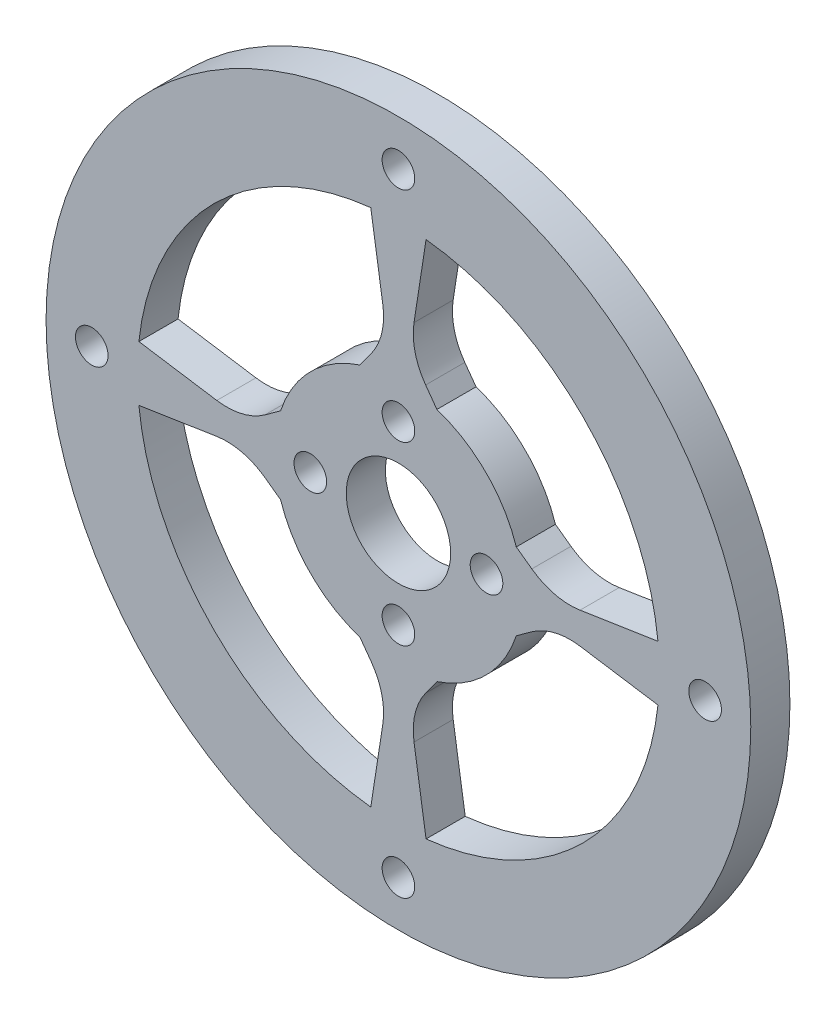
from build123d import *

# Parameters (mm, degrees)
SKETCH1_R             = 27
SKETCH1_R_2           = 1.25
SKETCH1_R_3           = 20
BOSS_EXTRUDE1_DEPTH   = 3
SKETCH1_R_4           = 9.5
SKETCH1_R_5           = 4
BOSS_EXTRUDE1_2_DEPTH = 3
BOSS_EXTRUDE2_DEPTH   = 3


with BuildPart() as part:
    # Sketch1 → Boss-Extrude1 (new body)
    with BuildSketch(Plane.XY):
        Circle(SKETCH1_R)
        with Locations((23.5, 0)):
            Circle(SKETCH1_R_2, mode=Mode.SUBTRACT)
        with Locations((0, -23.5)):
            Circle(SKETCH1_R_2, mode=Mode.SUBTRACT)
        with Locations((-23.5, 0)):
            Circle(SKETCH1_R_2, mode=Mode.SUBTRACT)
        with Locations((0, 23.5)):
            Circle(SKETCH1_R_2, mode=Mode.SUBTRACT)
        Circle(SKETCH1_R_3, mode=Mode.SUBTRACT)
    extrude(amount=BOSS_EXTRUDE1_DEPTH)



with BuildPart() as body_2:
    # Sketch1 → Boss-Extrude1 2 (new body)
    with BuildSketch(Plane.XY):
        Circle(SKETCH1_R_4)
        with Locations((6.75, 0)):
            Circle(SKETCH1_R_2, mode=Mode.SUBTRACT)
        with Locations((0, -6.75)):
            Circle(SKETCH1_R_2, mode=Mode.SUBTRACT)
        with Locations((-6.75, 0)):
            Circle(SKETCH1_R_2, mode=Mode.SUBTRACT)
        with Locations((0, 6.75)):
            Circle(SKETCH1_R_2, mode=Mode.SUBTRACT)
        Circle(SKETCH1_R_5, mode=Mode.SUBTRACT)
    extrude(amount=BOSS_EXTRUDE1_2_DEPTH)


with BuildPart() as part_1:
    add(part.part)

    add(body_2.part)  # Boss-Extrude2 merges body 2
    # Sketch2 → Boss-Extrude2 (add)
    with BuildSketch(Plane.XY):
        with BuildLine():
            ThreePointArc((-13.918195932, 1.194775158), (-11.982498043, 1.275378496), (-10.222750069, 2.085755129))
            Line((-10.222750069, 2.085755129), (-9.030872227, 2.948448204))
            Line((-9.030872227, 2.948448204), (-9.030872227, -2.948448204))
            Line((-9.030872227, -2.948448204), (-10.222750069, -2.085755129))
            ThreePointArc((-10.222750069, -2.085755129), (-11.982498043, -1.275378496), (-13.918195932, -1.194775158))
            Line((-13.918195932, -1.194775158), (-19.887594178, -2.117450782))
            Line((-19.887594178, -2.117450782), (-20.214883486, 0))
            Line((-20.214883486, 0), (-19.887594178, 2.117450782))
            Line((-19.887594178, 2.117450782), (-13.918195932, 1.194775158))
        make_face()
        with BuildLine():
            Line((0, 20.214883486), (2.117450782, 19.887594178))
            Line((2.117450782, 19.887594178), (1.194775158, 13.918195932))
            ThreePointArc((1.194775158, 13.918195932), (1.275378496, 11.982498043), (2.085755129, 10.222750069))
            Line((2.085755129, 10.222750069), (2.948448204, 9.030872227))
            Line((2.948448204, 9.030872227), (-2.948448204, 9.030872227))
            Line((-2.948448204, 9.030872227), (-2.085755129, 10.222750069))
            ThreePointArc((-2.085755129, 10.222750069), (-1.275378496, 11.982498043), (-1.194775158, 13.918195932))
            Line((-1.194775158, 13.918195932), (-2.117450782, 19.887594178))
            Line((-2.117450782, 19.887594178), (0, 20.214883486))
        make_face()
        with BuildLine():
            Line((19.887594178, -2.117450782), (13.918195932, -1.194775158))
            ThreePointArc((13.918195932, -1.194775158), (11.982498043, -1.275378496), (10.222750069, -2.085755129))
            Line((10.222750069, -2.085755129), (9.030872227, -2.948448204))
            Line((9.030872227, -2.948448204), (9.030872227, 2.948448204))
            Line((9.030872227, 2.948448204), (10.222750069, 2.085755129))
            ThreePointArc((10.222750069, 2.085755129), (11.982498043, 1.275378496), (13.918195932, 1.194775158))
            Line((13.918195932, 1.194775158), (19.887594178, 2.117450782))
            Line((19.887594178, 2.117450782), (20.214883486, 0))
            Line((20.214883486, 0), (19.887594178, -2.117450782))
        make_face()
        with BuildLine():
            Line((2.117450782, -19.887594178), (1.194775158, -13.918195932))
            ThreePointArc((1.194775158, -13.918195932), (1.275378496, -11.982498043), (2.085755129, -10.222750069))
            Line((2.085755129, -10.222750069), (2.948448204, -9.030872227))
            Line((2.948448204, -9.030872227), (-2.948448204, -9.030872227))
            Line((-2.948448204, -9.030872227), (-2.085755129, -10.222750069))
            ThreePointArc((-2.085755129, -10.222750069), (-1.275378496, -11.982498043), (-1.194775158, -13.918195932))
            Line((-1.194775158, -13.918195932), (-2.117450782, -19.887594178))
            Line((-2.117450782, -19.887594178), (0, -20.214883486))
            Line((0, -20.214883486), (2.117450782, -19.887594178))
        make_face()
    extrude(amount=BOSS_EXTRUDE2_DEPTH)


solid = part_1.part
